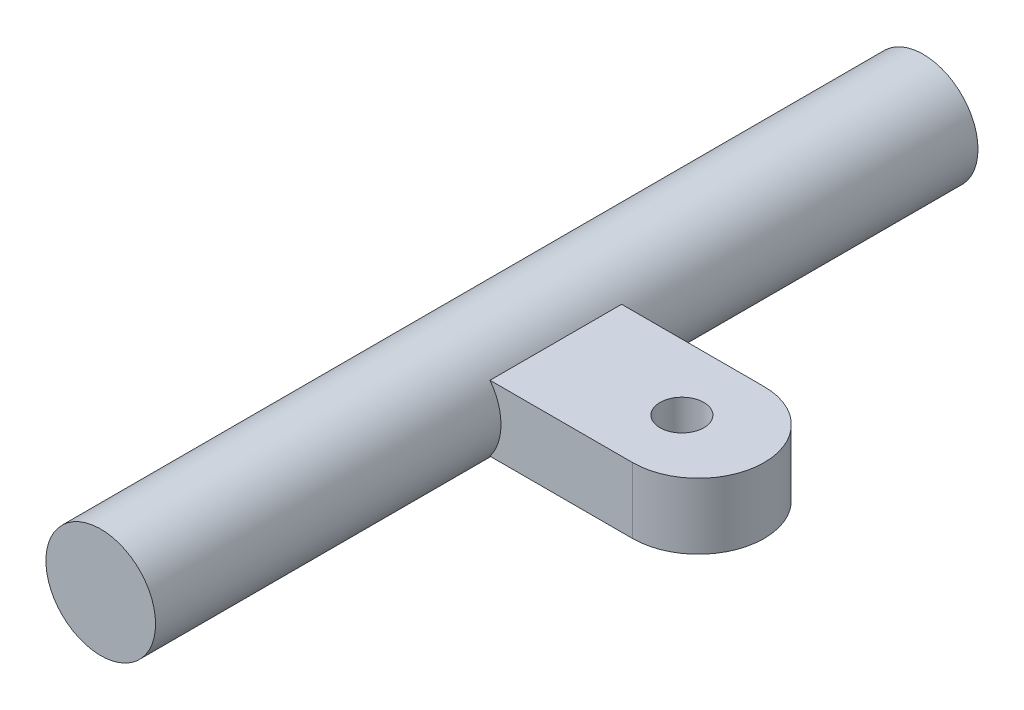
from build123d import *

# Parameters (mm, degrees)
SKETCH3_R           = 2
BOSS_EXTRUDE1_DEPTH = 3
SKETCH6_R           = 5
BOSS_EXTRUDE2_DEPTH = 37.5


with BuildPart() as part:
    # Sketch3 → Boss-Extrude1 (new, symmetric)
    with BuildSketch(Plane(origin=(0, 0, 0), x_dir=(1, 0, 0), z_dir=(0, 1, 0))):
        with BuildLine():
            Line((8.5, -6), (-8.5, -6))
            Line((-8.5, -6), (-8.5, 6))
            Line((-8.5, 6), (8.5, 6))
            ThreePointArc((8.5, 6), (14.5, 0), (8.5, -6))
        make_face()
        with Locations(Location((7, 0, 0), (0, 0, 270))):
            Circle(SKETCH3_R, mode=Mode.SUBTRACT)
    extrude(amount=BOSS_EXTRUDE1_DEPTH, both=True)

    # Sketch6 → Boss-Extrude2 (add, symmetric)
    with BuildSketch(Plane.XY):
        with Locations((-8.5, 0)):
            Circle(SKETCH6_R)
    extrude(amount=BOSS_EXTRUDE2_DEPTH, both=True)


solid = part.part
